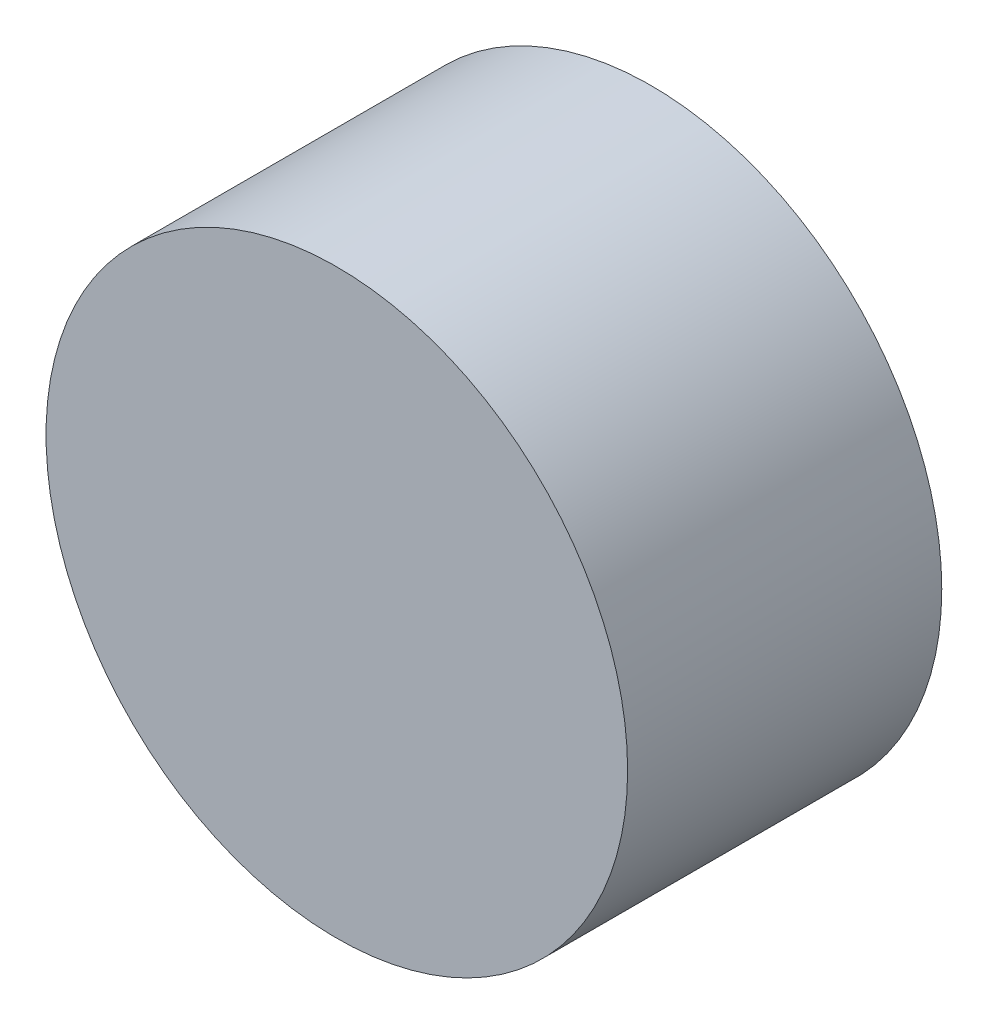
from build123d import *

# Parameters (mm, degrees)
SKETCH2_R           = 34.25
BOSS_EXTRUDE1_DEPTH = 37


with BuildPart() as part:
    # Sketch2 → Boss-Extrude1 (new body)
    with BuildSketch(Plane.XY):
        Circle(SKETCH2_R)
    extrude(amount=BOSS_EXTRUDE1_DEPTH)


solid = part.part
